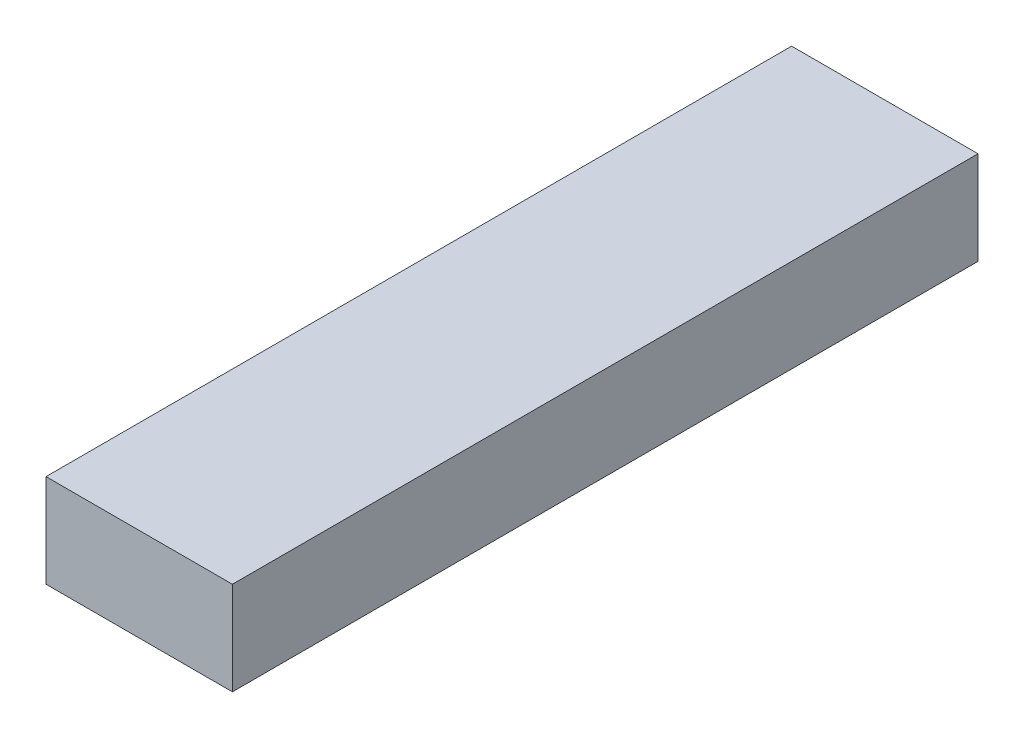
from build123d import *

# Parameters (mm, degrees)
PROFILE1_W = 10
PROFILE1_H = 5


with BuildPart() as part:
    # modern_sweep_twist1_90: sweep along a path in Path1
    with BuildLine(Plane(origin=(0, 0, 0), x_dir=(0, 0, -1), z_dir=(1, 0, 0))) as modern_sweep_twist1_90_path:
        Line((0, 0), (-40, 0))
    # Profile1 → modern_sweep_twist1_90 (sweep)
    with BuildSketch(Plane.XY):
        Rectangle(PROFILE1_W, PROFILE1_H)
    sweep(path=modern_sweep_twist1_90_path.line)


solid = part.part
